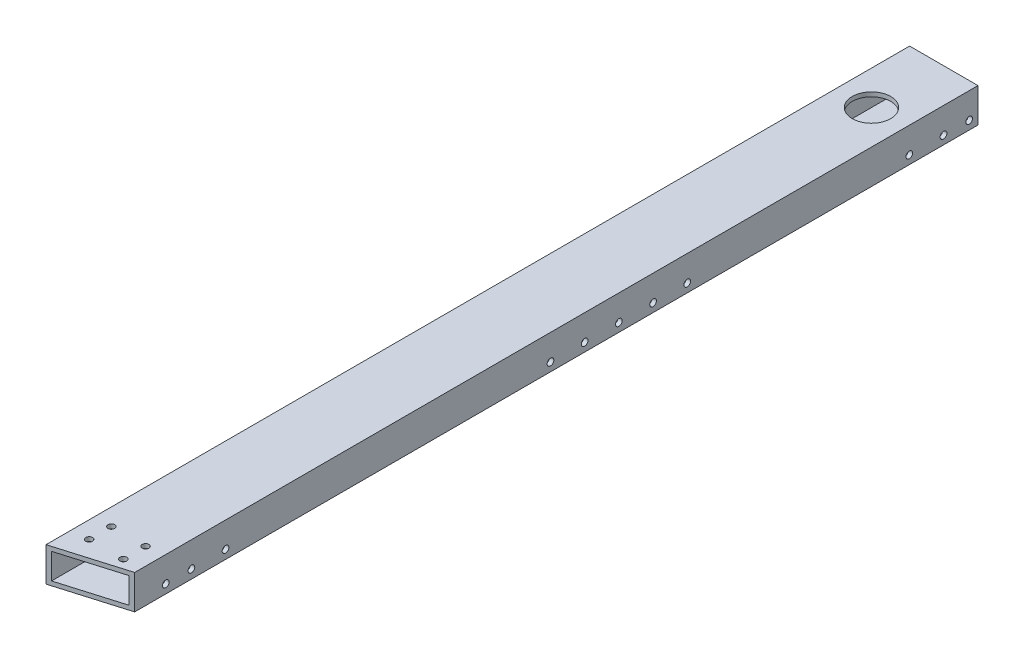
from build123d import *

# Parameters (mm, degrees)
BOSS_EXTRUDE1_DEPTH        = 320.675
BOSS_EXTRUDE1_DEPTH_BACK   = 320.675
SKETCH3_W                  = 50.8
SKETCH3_H                  = 25.4
SKETCH3_W_2                = 44.45
SKETCH3_H_2                = 19.05
CUT_EXTRUDE1_DEPTH         = 323.680609311
CUT_EXTRUDE1_DEPTH_BACK    = 323.680609311
SKETCH8_R                  = 14.2875
CUT_EXTRUDE2_DEPTH         = 323.680609311
F_10_CLEARANCE_HOLE1_D     = 4.9784
F_10_CLEARANCE_HOLE1_DEPTH = 5.08
F_10_CLEARANCE_HOLE1_TIP   = 1.495662253
F_10_CLEARANCE_HOLE2_D     = 4.9784
F_10_CLEARANCE_HOLE3_D     = 4.9784
F_10_CLEARANCE_HOLE3_DEPTH = 3.302
F_10_CLEARANCE_HOLE3_TIP   = 1.495662253


with BuildPart() as part:
    # Sketch3 → Boss-Extrude1 (new, two sides: drawn at the far end of the back side and taken through both)
    with BuildSketch(Plane.XY.offset(-BOSS_EXTRUDE1_DEPTH_BACK)):
        Rectangle(SKETCH3_W, SKETCH3_H)
        Rectangle(SKETCH3_W_2, SKETCH3_H_2, mode=Mode.SUBTRACT)
    extrude(amount=BOSS_EXTRUDE1_DEPTH + BOSS_EXTRUDE1_DEPTH_BACK)

    # Sketch4 → Cut-Extrude1 (cut, two sides: drawn at the far end of the back side and taken through both)
    with BuildSketch(Plane(origin=(0, 12.7, 0), x_dir=(1, 0, 0), z_dir=(0, 1, 0)).offset(-CUT_EXTRUDE1_DEPTH_BACK)):
        Polygon((1322.117470931, -320.675), (25.4, -320.675), (-25.4, -320.675), (25.4, -305.627354456), (1268.718301677, 62.660305034), (3837.350959621, 420.474595165), (3890.750128875, 37.139290131), align=None)
    extrude(amount=CUT_EXTRUDE1_DEPTH + CUT_EXTRUDE1_DEPTH_BACK, mode=Mode.SUBTRACT)

    # Sketch8 → Cut-Extrude2 (cut, through all)
    with BuildSketch(Plane(origin=(0, 12.7, 0), x_dir=(1, 0, 0), z_dir=(0, 1, 0))):
        with Locations(Location((0, 266.954, 0), (0, 0, 180))):
            Circle(SKETCH8_R)
    extrude(amount=-CUT_EXTRUDE2_DEPTH, mode=Mode.SUBTRACT)

    # #10 Clearance Hole1
    with Locations(Plane(origin=(0, 12.7, 0), x_dir=(1, 0, 0), z_dir=(0, 1, 0))):
        with Locations((-12.7762, -284.753033923), (12.6238, -284.753033923), (12.6238, -301.263033923), (-12.7762, -301.263033923)):
            Hole(F_10_CLEARANCE_HOLE1_D / 2, depth=F_10_CLEARANCE_HOLE1_DEPTH)
            with Locations((0, 0, -(F_10_CLEARANCE_HOLE1_DEPTH + F_10_CLEARANCE_HOLE1_TIP / 2))):  # 118° drill point
                Cone(0, F_10_CLEARANCE_HOLE1_D / 2, F_10_CLEARANCE_HOLE1_TIP, mode=Mode.SUBTRACT)

    # #10 Clearance Hole2 (through all)
    with Locations(Plane(origin=(25.4, 0, 0), x_dir=(0, 0, -1), z_dir=(1, 0, 0))):
        with Locations((-282.536770585, -6.148316496), (-263.486770585, -6.148316496), (-238.125, -6.148316496), (3.175, -6.35), (28.575, -6.35), (53.975, -6.35), (79.375, -6.35), (104.775, -6.35)):
            Hole(F_10_CLEARANCE_HOLE2_D / 2)

    # #10 Clearance Hole3
    with Locations(Plane(origin=(25.4, 0, 0), x_dir=(0, 0, -1), z_dir=(1, 0, 0))):
        with Locations((269.673316496, -6.388229415), (295.073316496, -6.388229415), (314.123316496, -6.388229415)):
            Hole(F_10_CLEARANCE_HOLE3_D / 2, depth=F_10_CLEARANCE_HOLE3_DEPTH)
            with Locations((0, 0, -(F_10_CLEARANCE_HOLE3_DEPTH + F_10_CLEARANCE_HOLE3_TIP / 2))):  # 118° drill point
                Cone(0, F_10_CLEARANCE_HOLE3_D / 2, F_10_CLEARANCE_HOLE3_TIP, mode=Mode.SUBTRACT)


solid = part.part
